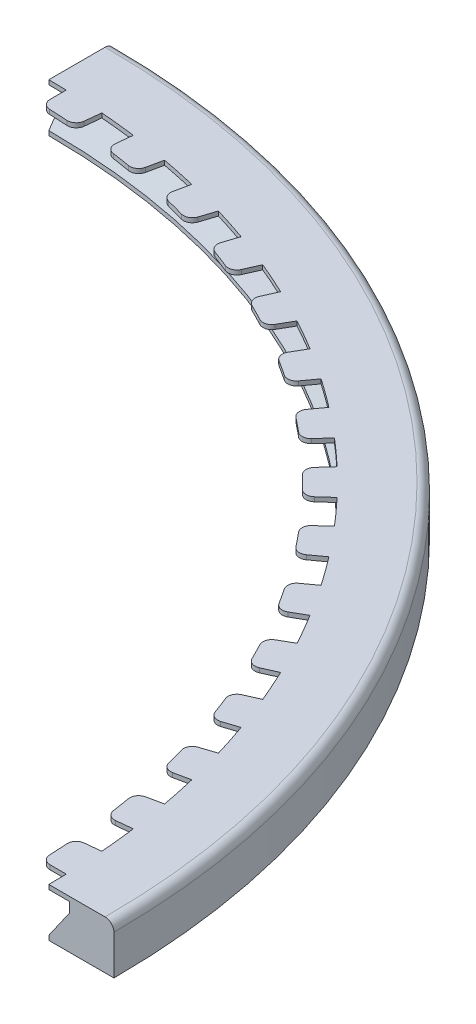
from build123d import *

# Parameters (mm, degrees)
CUT_EXTRUDE1_DEPTH             = 245.198363836
CIRPATTERN1_COUNT              = 60
CUT_EXTRUDE2_DEPTH             = 25.4
FILLET1_R                      = 2
F_6_0_204_DIAMETER_HOLE1_D     = 4.318
F_6_0_204_DIAMETER_HOLE1_DEPTH = 8
F_6_0_204_DIAMETER_HOLE1_TIP   = 1.297258076
FILLET2_R                      = 2


with BuildPart() as part:
    # Sketch1 → Revolve1 (revolve)
    with BuildSketch(Plane.XY, mode=Mode.PRIVATE) as revolve1_sk:
        Polygon((-157.75, -10.97), (-157.75, -9.97), (-162.5, -3.186296968), (-162.5, -1), (-152.165, -1), (-152.165, 0), (-172.5, 0), (-172.5, -10.97), align=None)
    revolve(revolve1_sk.sketch.rotate(Axis((0, 0, 0), (0, 1, 0)), 270), axis=Axis((0, 0, 0), (0, 1, 0)))

    # Sketch2 → Cut-Extrude1 (cut, symmetric)
    with BuildSketch(Plane(origin=(0, 0, 0), x_dir=(1, 0, 0), z_dir=(0, 1, 0))):
        with BuildLine():
            Line((-4, 150.699278692), (4, 150.699278692))
            Line((4, 150.699278692), (4, 157.699278692))
            ThreePointArc((4, 157.699278692), (0, 157.75), (-4, 157.699278692))
            Line((-4, 157.699278692), (-4, 150.699278692))
        make_face()
    cut_extrude1 = extrude(amount=CUT_EXTRUDE1_DEPTH, both=True, mode=Mode.SUBTRACT)

    # CirPattern1: Cut-Extrude1 ×60 about axis
    cirpattern1_axis = Axis((0, 0, 0), (0, 1, 0))
    for i in range(1, CIRPATTERN1_COUNT):
        add(cut_extrude1.rotate(cirpattern1_axis, i * 360 / CIRPATTERN1_COUNT), mode=Mode.SUBTRACT)

    # Sketch6 → Cut-Extrude2 (cut, symmetric)
    with BuildSketch(Plane(origin=(0, 0, 0), x_dir=(1, 0, 0), z_dir=(0, 1, 0))):
        with BuildLine():
            Line((0, 0), (0, 216.30546713))
            ThreePointArc((0, 216.30546713), (-152.951062615, -152.951062615), (216.30546713, 0))
            Line((216.30546713, 0), (0, 0))
        make_face()
    extrude(amount=CUT_EXTRUDE2_DEPTH, both=True, mode=Mode.SUBTRACT)

    # Fillet1
    fillet1_edges = [part.edges().sort_by_distance(p)[0] for p in [
        (4, -0.5, -152.112416406),
        (11.921989549, -0.5, -151.697242527),
        (27.713359286, -0.5, -149.620041913),
        (35.538540092, -0.5, -147.956748386),
        (43.20109566, -0.5, -145.90357281),
        (19.878164712, -0.5, -150.86101482),
        (50.80954779, -0.5, -143.431436855),
        (58.215511789, -0.5, -140.588553631),
        (65.52387545, -0.5, -137.334660487),
        (72.592106588, -0.5, -133.733216839),
        (79.520309818, -0.5, -129.733216839),
        (86.173367077, -0.5, -125.412670937),
        (92.645503032, -0.5, -120.710388919),
        (98.810494123, -0.5, -115.718077569),
        (104.755652727, -0.5, -110.365032718),
        (110.365032718, -0.5, -104.755652727),
        (115.718077569, -0.5, -98.810494123),
        (120.710388919, -0.5, -92.645503032),
        (125.412670937, -0.5, -86.173367077),
        (129.733216839, -0.5, -79.520309818),
        (133.733216839, -0.5, -72.592106588),
        (137.334660487, -0.5, -65.52387545),
        (140.588553631, -0.5, -58.215511789),
        (143.431436855, -0.5, -50.80954779),
        (145.90357281, -0.5, -43.20109566),
        (147.956748386, -0.5, -35.538540092),
        (149.620041913, -0.5, -27.713359286),
        (150.86101482, -0.5, -19.878164712),
        (151.697242527, -0.5, -11.921989549),
        (152.112416406, -0.5, -4),
    ]]
    fillet(fillet1_edges, radius=FILLET1_R)

    # #6 (0.204) Diameter Hole1
    with Locations(Plane(origin=(0, -10.97, 0), x_dir=(-1, 0, 0), z_dir=(0, -1, 0))):
        with Locations((-64.290816637, 155.211761462), (-155.211761462, 64.290816637)):
            Hole(F_6_0_204_DIAMETER_HOLE1_D / 2, depth=F_6_0_204_DIAMETER_HOLE1_DEPTH)
            with Locations((0, 0, -(F_6_0_204_DIAMETER_HOLE1_DEPTH + F_6_0_204_DIAMETER_HOLE1_TIP / 2))):  # 118° drill point
                Cone(0, F_6_0_204_DIAMETER_HOLE1_D / 2, F_6_0_204_DIAMETER_HOLE1_TIP, mode=Mode.SUBTRACT)

    # Fillet2
    fillet2_edges = [part.edges().sort_by_distance(p)[0] for p in [
        (121.975919755, 0, -121.975919755),
    ]]
    fillet(fillet2_edges, radius=FILLET2_R)


solid = part.part
